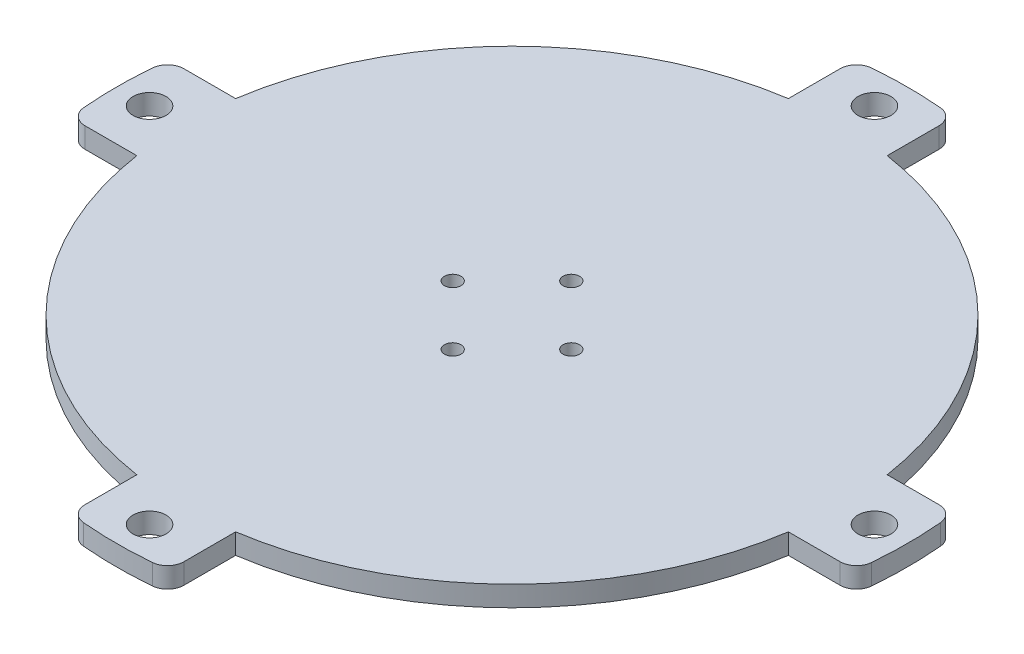
from build123d import *

# Parameters (mm, degrees)
SKETCH1_R           = 5
BOSS_EXTRUDE1_DEPTH = 6.2
CUT_EXTRUDE1_REACH  = 171.819
SKETCH2_R           = 2.5


with BuildPart() as part:
    # Sketch1 → Boss-Extrude1 (new body)
    with BuildSketch(Plane(origin=(0, 0, 0), x_dir=(1, 0, 0), z_dir=(0, 1, 0))):
        with BuildLine():
            Line((-15, -114.564392374), (-15, -98.868599666))
            ThreePointArc((-15, -98.868599666), (-70.710678119, -70.710678119), (-98.868599666, -15))
            Line((-98.868599666, -15), (-114.564392374, -15))
            ThreePointArc((-114.564392374, -15), (-117.942711997, -13.686048904), (-119.545452912, -10.434782609))
            ThreePointArc((-119.545452912, -10.434782609), (-120, 0), (-119.545452912, 10.434782609))
            ThreePointArc((-119.545452912, 10.434782609), (-117.942711997, 13.686048904), (-114.564392374, 15))
            Line((-114.564392374, 15), (-98.868599666, 15))
            ThreePointArc((-98.868599666, 15), (-70.710678119, 70.710678119), (-15, 98.868599666))
            Line((-15, 98.868599666), (-15, 114.564392374))
            ThreePointArc((-15, 114.564392374), (-13.686048904, 117.942711997), (-10.434782609, 119.545452912))
            ThreePointArc((-10.434782609, 119.545452912), (0, 120), (10.434782609, 119.545452912))
            ThreePointArc((10.434782609, 119.545452912), (13.686048904, 117.942711997), (15, 114.564392374))
            Line((15, 114.564392374), (15, 98.868599666))
            ThreePointArc((15, 98.868599666), (70.710678119, 70.710678119), (98.868599666, 15))
            Line((98.868599666, 15), (114.564392374, 15))
            ThreePointArc((114.564392374, 15), (117.942711997, 13.686048904), (119.545452912, 10.434782609))
            ThreePointArc((119.545452912, 10.434782609), (120, 0), (119.545452912, -10.434782609))
            ThreePointArc((119.545452912, -10.434782609), (117.942711997, -13.686048904), (114.564392374, -15))
            Line((114.564392374, -15), (98.868599666, -15))
            ThreePointArc((98.868599666, -15), (70.710678119, -70.710678119), (15, -98.868599666))
            Line((15, -98.868599666), (15, -114.564392374))
            ThreePointArc((15, -114.564392374), (13.686048904, -117.942711997), (10.434782609, -119.545452912))
            ThreePointArc((10.434782609, -119.545452912), (0, -120), (-10.434782609, -119.545452912))
            ThreePointArc((-10.434782609, -119.545452912), (-13.686048904, -117.942711997), (-15, -114.564392374))
        make_face()
        with Locations(Location((0, -110, 0), (0, 0, 270))):
            Circle(SKETCH1_R, mode=Mode.SUBTRACT)
        with Locations(Location((-110, 0, 0), (0, 0, 270))):
            Circle(SKETCH1_R, mode=Mode.SUBTRACT)
        with Locations(Location((0, 110, 0), (0, 0, 270))):
            Circle(SKETCH1_R, mode=Mode.SUBTRACT)
        with Locations(Location((110, 0, 0), (0, 0, 270))):
            Circle(SKETCH1_R, mode=Mode.SUBTRACT)
    extrude(amount=-BOSS_EXTRUDE1_DEPTH)

    # Sketch2 → Cut-Extrude1 (cut, up to next)
    with BuildSketch(Plane.XZ.offset(6.2), mode=Mode.PRIVATE) as cut_extrude1_sk1:
        with Locations(Location((18, 0, 0), (0, 0, 270))):
            Circle(SKETCH2_R)
    cut_extrude1_tool1 = extrude(cut_extrude1_sk1.sketch, amount=-CUT_EXTRUDE1_REACH, mode=Mode.PRIVATE) & part.part
    # Sketch2 → Cut-Extrude1 (cut, up to next)
    with BuildSketch(Plane.XZ.offset(6.2), mode=Mode.PRIVATE) as cut_extrude1_sk2:
        with Locations(Location((0, -18, 0), (0, 0, 270))):
            Circle(SKETCH2_R)
    cut_extrude1_tool2 = extrude(cut_extrude1_sk2.sketch, amount=-CUT_EXTRUDE1_REACH, mode=Mode.PRIVATE) & part.part
    # Sketch2 → Cut-Extrude1 (cut, up to next)
    with BuildSketch(Plane.XZ.offset(6.2), mode=Mode.PRIVATE) as cut_extrude1_sk3:
        with Locations(Location((-18, 0, 0), (0, 0, 270))):
            Circle(SKETCH2_R)
    cut_extrude1_tool3 = extrude(cut_extrude1_sk3.sketch, amount=-CUT_EXTRUDE1_REACH, mode=Mode.PRIVATE) & part.part
    # Sketch2 → Cut-Extrude1 (cut, up to next)
    with BuildSketch(Plane.XZ.offset(6.2), mode=Mode.PRIVATE) as cut_extrude1_sk4:
        with Locations(Location((0, 18, 0), (0, 0, 270))):
            Circle(SKETCH2_R)
    cut_extrude1_tool4 = extrude(cut_extrude1_sk4.sketch, amount=-CUT_EXTRUDE1_REACH, mode=Mode.PRIVATE) & part.part
    add(cut_extrude1_tool1.solids().sort_by_distance((18, -6.2, 0))[0], mode=Mode.SUBTRACT)
    add(cut_extrude1_tool2.solids().sort_by_distance((0, -6.2, -18))[0], mode=Mode.SUBTRACT)
    add(cut_extrude1_tool3.solids().sort_by_distance((-18, -6.2, 0))[0], mode=Mode.SUBTRACT)
    add(cut_extrude1_tool4.solids().sort_by_distance((0, -6.2, 18))[0], mode=Mode.SUBTRACT)


solid = part.part
